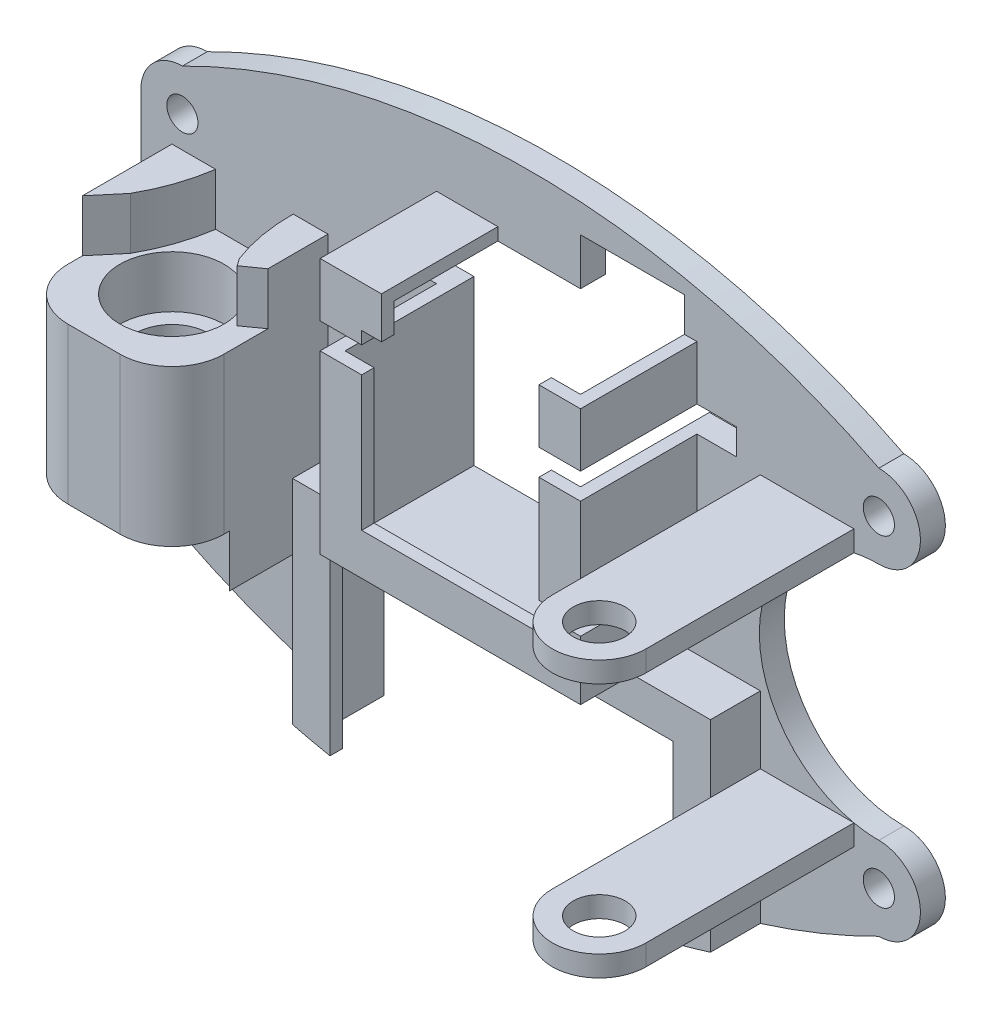
from build123d import *

# Parameters (mm, degrees)
CROQUIS1_R                 = 1.5
SALIENTE_EXTRUIR1_DEPTH    = 2.4
CROQUIS3_W                 = 25.05
CROQUIS3_H                 = 24.65
CROQUIS3_W_2               = 22.65
CROQUIS3_H_2               = 22.25
SALIENTE_EXTRUIR2_DEPTH    = 10
CROQUIS4_W                 = 25.05
CROQUIS4_H                 = 24.65
CROQUIS4_W_2               = 17.05
CROQUIS4_H_2               = 16.65
SALIENTE_EXTRUIR3_DEPTH    = 1.2
CROQUIS5_W                 = 4
CROQUIS5_H                 = 2.5
CROQUIS5_W_2               = 15.15
CROQUIS5_H_2               = 4
CROQUIS5_H_3               = 1
CORTAR_EXTRUIR1_DEPTH      = 11.2
CROQUIS8_W                 = 15
CROQUIS8_H                 = 15
SALIENTE_EXTRUIR5_DEPTH    = 15
CROQUIS10_R                = 5
CORTAR_EXTRUIR2_DEPTH      = 5
CORTAR_EXTRUIR3_START      = -10
CROQUIS10_2_R              = 5
CORTAR_EXTRUIR3_DEPTH      = 5
CROQUIS11_R                = 3.5
CORTAR_EXTRUIR4_DEPTH      = 5
CORTAR_EXTRUIR5_DEPTH      = 2.4
CORTAR_EXTRUIR6_DEPTH      = 10
CORTAR_EXTRUIR6_DEPTH_BACK = 2.4
CROQUIS13_W                = 10
CROQUIS13_H                = 4.5
REDONDEO1_R                = 5
CORTAR_EXTRUIR7_REACH      = 92.864
CROQUIS14_W                = 37
CROQUIS14_H                = 25
CROQUIS14_W_2              = 3
CROQUIS14_H_2              = 2
SALIENTE_EXTRUIR6_DEPTH    = 3.6
SALIENTE_EXTRUIR7_DEPTH    = 1.2
SALIENTE_EXTRUIR8_DEPTH    = 5
CORTAR_EXTRUIR8_DEPTH      = 5.000001
CROQUIS25_R                = 2.5
SALIENTE_EXTRUIR9_DEPTH    = 2


with BuildPart() as part:
    # Croquis1 → Saliente-Extruir1 (new body)
    with BuildSketch(Plane.XY):
        with BuildLine():
            Line((-65.940699516, 48.688511327), (-65.940699516, 17.688511327))
            ThreePointArc((-65.940699516, 17.688511327), (-64.76912664, 14.860084202), (-61.940699516, 13.688511327))
            ThreePointArc((-61.940699516, 13.688511327), (-28.440699516, 5.688511327), (5.059300484, 13.688511327))
            ThreePointArc((5.059300484, 13.688511327), (9.059300484, 17.688511327), (5.059300484, 21.688511327))
            ThreePointArc((5.059300484, 21.688511327), (-6.440699516, 33.188511327), (5.059300484, 44.688511327))
            ThreePointArc((5.059300484, 44.688511327), (9.059300484, 48.688511327), (5.059300484, 52.688511327))
            ThreePointArc((5.059300484, 52.688511327), (-28.440699516, 60.688511327), (-61.940699516, 52.688511327))
            ThreePointArc((-61.940699516, 52.688511327), (-64.76912664, 51.516938452), (-65.940699516, 48.688511327))
        make_face()
        with Locations((-61.940699516, 48.688511327)):
            Circle(CROQUIS1_R, mode=Mode.SUBTRACT)
        with Locations((5.059300484, 48.688511327)):
            Circle(CROQUIS1_R, mode=Mode.SUBTRACT)
        with Locations((5.059300484, 17.688511327)):
            Circle(CROQUIS1_R, mode=Mode.SUBTRACT)
        with Locations((-61.940699516, 17.688511327)):
            Circle(CROQUIS1_R, mode=Mode.SUBTRACT)
    extrude(amount=SALIENTE_EXTRUIR1_DEPTH)

    # Croquis3 → Saliente-Extruir2 (add)
    with BuildSketch(Plane.XY.offset(2.4)):
        with Locations((-24.965699516, 42.160543548)):
            Rectangle(CROQUIS3_W, CROQUIS3_H)
        with Locations((-24.965699516, 42.160543548)):
            Rectangle(CROQUIS3_W_2, CROQUIS3_H_2, mode=Mode.SUBTRACT)
    extrude(amount=SALIENTE_EXTRUIR2_DEPTH)

    # Croquis4 → Saliente-Extruir3 (add)
    with BuildSketch(Plane.XY.offset(12.4)):
        with Locations((-24.965699516, 42.160543548)):
            Rectangle(CROQUIS4_W, CROQUIS4_H)
        with Locations((-24.965699516, 42.160543548)):
            Rectangle(CROQUIS4_W_2, CROQUIS4_H_2, mode=Mode.SUBTRACT)
    extrude(amount=SALIENTE_EXTRUIR3_DEPTH)

    # Croquis5 → Cortar-Extruir1 (cut)
    with BuildSketch(Plane.XY.offset(13.6)):
        with Locations((-35.490699516, 48.035543548)):
            Rectangle(CROQUIS5_W, CROQUIS5_H)
        with Locations((-24.015699516, 52.485543548)):
            Rectangle(CROQUIS5_W_2, CROQUIS5_H_2)
        with Locations((-14.440699516, 36.035543548)):
            Rectangle(CROQUIS5_W, CROQUIS5_H_3)
        with Locations((-14.440699516, 48.035543548)):
            Rectangle(CROQUIS5_W, CROQUIS5_H)
    extrude(amount=-CORTAR_EXTRUIR1_DEPTH, mode=Mode.SUBTRACT)

    # Croquis8 → Saliente-Extruir5 (add)
    with BuildSketch(Plane.XY.offset(2.4)):
        with Locations((-55.440699516, 33.188511327)):
            Rectangle(CROQUIS8_W, CROQUIS8_H)
    extrude(amount=SALIENTE_EXTRUIR5_DEPTH)

    # Croquis10 → Cortar-Extruir2 (cut)
    with BuildSketch(Plane.XZ.offset(-25.688511327)):
        with Locations(Location((-55.440699516, 9.9, 0), (0, 0, 270))):
            Circle(CROQUIS10_R)
    extrude(amount=-CORTAR_EXTRUIR2_DEPTH, mode=Mode.SUBTRACT)

    # Croquis10<2> → Cortar-Extruir3 (cut)
    with BuildSketch(Plane.XZ.offset(-25.688511327).offset(CORTAR_EXTRUIR3_START)):
        with Locations(Location((-55.440699516, 9.9, 0), (0, 0, 270))):
            Circle(CROQUIS10_2_R)
    extrude(amount=-CORTAR_EXTRUIR3_DEPTH, mode=Mode.SUBTRACT)

    # Croquis11 → Cortar-Extruir4 (cut)
    with BuildSketch(Plane.XZ.offset(-30.688511327)):
        with Locations(Location((-55.440699516, 9.9, 0), (0, 0, 270))):
            Circle(CROQUIS11_R)
    extrude(amount=-CORTAR_EXTRUIR4_DEPTH, mode=Mode.SUBTRACT)

    # Croquis12 → Cortar-Extruir5 (cut)
    with BuildSketch(Plane.XY.offset(2.4)):
        Polygon((-36.290699516, 53.285543548), (-13.640699516, 53.285543548), (-13.640699516, 49.285543548), (-8.640699516, 49.285543548), (-8.640699516, 46.785543548), (-13.640699516, 46.785543548), (-13.640699516, 31.035543548), (-36.290699516, 31.035543548), (-36.290699516, 46.785543548), (-41.290699516, 46.785543548), (-41.290699516, 49.285543548), (-36.290699516, 49.285543548), align=None)
    extrude(amount=-CORTAR_EXTRUIR5_DEPTH, mode=Mode.SUBTRACT)

    # Croquis13 → Cortar-Extruir6 (cut, two sides: drawn at the far end of the back side and taken through both)
    with BuildSketch(Plane.XY.offset(2.4).offset(-CORTAR_EXTRUIR6_DEPTH_BACK)):
        with Locations((-18.640699516, 55.535543548)):
            Rectangle(CROQUIS13_W, CROQUIS13_H)
    extrude(amount=CORTAR_EXTRUIR6_DEPTH + CORTAR_EXTRUIR6_DEPTH_BACK, mode=Mode.SUBTRACT)

    # Redondeo1
    redondeo1_edges = [part.edges().sort_by_distance(p)[0] for p in [
        (-62.940699516, 33.188511327, 17.4),
        (-47.940699516, 33.188511327, 17.4),
    ]]
    fillet(redondeo1_edges, radius=REDONDEO1_R)

    # Croquis14 → Cortar-Extruir7 (cut, up to next)
    with BuildSketch(Plane.XY.offset(2.4), mode=Mode.PRIVATE) as cortar_extruir7_sk1:
        with Locations((-26.440699516, 14.335543548)):
            Rectangle(CROQUIS14_W, CROQUIS14_H)
    cortar_extruir7_tool1 = extrude(cortar_extruir7_sk1.sketch, amount=-CORTAR_EXTRUIR7_REACH, mode=Mode.PRIVATE) & part.part
    # Croquis14 → Cortar-Extruir7 (cut, up to next)
    with BuildSketch(Plane.XY.offset(2.4), mode=Mode.PRIVATE) as cortar_extruir7_sk2:
        with Locations((-32.490699516, 28.835543548)):
            Rectangle(CROQUIS14_W_2, CROQUIS14_H_2)
    cortar_extruir7_tool2 = extrude(cortar_extruir7_sk2.sketch, amount=-CORTAR_EXTRUIR7_REACH, mode=Mode.PRIVATE) & part.part
    add(cortar_extruir7_tool1.solids().sort_by_distance((-26.4407, 14.335544, 2.4))[0], mode=Mode.SUBTRACT)
    add(cortar_extruir7_tool2.solids().sort_by_distance((-32.4907, 28.835544, 2.4))[0], mode=Mode.SUBTRACT)

    # Croquis15 → Saliente-Extruir6 (add)
    with BuildSketch(Plane.XY.offset(2.4)):
        with BuildLine():
            Line((-44.940699516, 7.547864372), (-44.940699516, 26.835543548))
            Line((-44.940699516, 26.835543548), (-33.990699516, 26.835543548))
            Line((-33.990699516, 26.835543548), (-33.990699516, 28.435543548))
            Line((-33.990699516, 28.435543548), (-46.540699516, 28.435543548))
            Line((-46.540699516, 28.435543548), (-46.540699516, 7.931832654))
            ThreePointArc((-46.540699516, 7.931832654), (-45.74176474, 7.73540971), (-44.940699516, 7.547864372))
        make_face()
        with BuildLine():
            Line((-7.940699516, 26.835543548), (-7.940699516, 8.578997552))
            ThreePointArc((-7.940699516, 8.578997552), (-7.139347833, 8.814456916), (-6.340699516, 9.058928786))
            Line((-6.340699516, 9.058928786), (-6.340699516, 28.435543548))
            Line((-6.340699516, 28.435543548), (-30.990699516, 28.435543548))
            Line((-30.990699516, 28.435543548), (-30.990699516, 26.835543548))
            Line((-30.990699516, 26.835543548), (-7.940699516, 26.835543548))
        make_face()
    extrude(amount=SALIENTE_EXTRUIR6_DEPTH)

    # Croquis16 → Saliente-Extruir7 (add)
    with BuildSketch(Plane.XY.offset(6)):
        with BuildLine():
            Line((-33.990699516, 28.435543548), (-46.540699516, 28.435543548))
            Line((-46.540699516, 28.435543548), (-46.540699516, 7.931832654))
            ThreePointArc((-46.540699516, 7.931832654), (-44.745749867, 7.50363869), (-42.940699516, 7.120249144))
            Line((-42.940699516, 7.120249144), (-42.940699516, 24.835543548))
            Line((-42.940699516, 24.835543548), (-33.990699516, 24.835543548))
            Line((-33.990699516, 24.835543548), (-33.990699516, 28.435543548))
        make_face()
        with BuildLine():
            Line((-30.990699516, 28.435543548), (-6.340699516, 28.435543548))
            Line((-6.340699516, 28.435543548), (-6.340699516, 9.058928786))
            ThreePointArc((-6.340699516, 9.058928786), (-8.134228504, 8.523600003), (-9.940699516, 8.033716728))
            Line((-9.940699516, 8.033716728), (-9.940699516, 24.835543548))
            Line((-9.940699516, 24.835543548), (-30.990699516, 24.835543548))
            Line((-30.990699516, 24.835543548), (-30.990699516, 28.435543548))
        make_face()
    extrude(amount=SALIENTE_EXTRUIR7_DEPTH)

    # Croquis20 → Saliente-Extruir8 (add)
    with BuildSketch(Plane.XZ.offset(-25.688511327)):
        with BuildLine():
            Line((-62.940699516, 2.4), (-62.940699516, 11.011952661))
            Line((-62.940699516, 11.011952661), (-60.839725603, 8.511570775))
            ThreePointArc((-60.839725603, 8.511570775), (-59.506404562, 5.553015225), (-58.73875169, 2.4))
            Line((-58.73875169, 2.4), (-62.940699516, 2.4))
        make_face()
        with BuildLine():
            Line((-47.940699516, 2.4), (-47.940699516, 11.849634175))
            Line((-47.940699516, 11.849634175), (-50.161985782, 8.702014116))
            ThreePointArc((-50.161985782, 8.702014116), (-51.018961055, 5.604072702), (-51.275019132, 2.4))
            Line((-51.275019132, 2.4), (-47.940699516, 2.4))
        make_face()
    saliente_extruir8 = extrude(amount=SALIENTE_EXTRUIR8_DEPTH)

    # Simetría1: Saliente-Extruir8 across plane
    add(saliente_extruir8.mirror(Plane(origin=(0, 33.188511327, 0), x_dir=(0, 0, 1), z_dir=(0, -1, 0))))

    # Croquis22 → Cortar-Extruir8 (cut)
    with BuildSketch(Plane(origin=(0, 45.688511327, 0), x_dir=(1, 0, 0), z_dir=(0, 1, 0))):
        Polygon((-47.940699516, -11.849634175), (-49.670456383, -9.398523981), (-47.940699516, -8.17782863), align=None)
    extrude(amount=-CORTAR_EXTRUIR8_DEPTH, mode=Mode.SUBTRACT)

    # Croquis25 → Saliente-Extruir9 (add)
    with BuildSketch(Plane(origin=(0, 21.941734011, 0), x_dir=(1, 0, 0), z_dir=(0, 1, 0))):
        with BuildLine():
            Line((-6.340699516, -22.4), (-6.340699516, -2.4))
            Line((-6.340699516, -2.4), (2.659300484, -2.4))
            Line((2.659300484, -2.4), (2.659300484, -22.4))
            ThreePointArc((2.659300484, -22.4), (-1.840699516, -26.9), (-6.340699516, -22.4))
        make_face()
        with Locations(Location((-1.840699516, -22.4, 0), (0, 0, 270))):
            Circle(CROQUIS25_R, mode=Mode.SUBTRACT)
    saliente_extruir9 = extrude(amount=-SALIENTE_EXTRUIR9_DEPTH)

    # Simetría2: Saliente-Extruir9 across plane
    add(saliente_extruir9.mirror(Plane(origin=(0, 33.188511327, 0), x_dir=(0, 0, 1), z_dir=(0, -1, 0))))


solid = part.part
